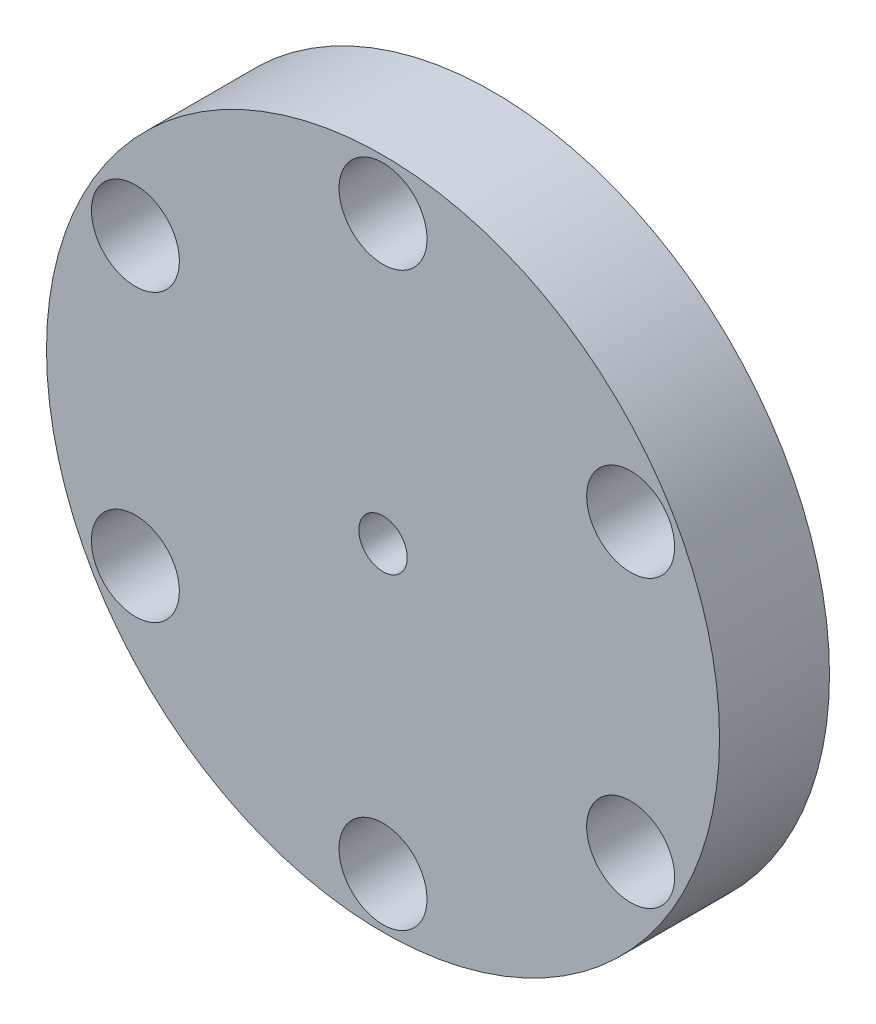
from build123d import *

# Parameters (mm, degrees)
SKETCH_1_R               = 15.3
SKETCH_1_R_2             = 1.1
EXTRUDE_1_DEPTH          = 2.5
SKETCH_2_R               = 1.25
CUT_EXTRUDE_1_DEPTH      = 23.207656337
SKETCH_2_2_R             = 2
CUT_EXTRUDE_2_DEPTH      = 3
PATTERN_CIRCULAR_1_COUNT = 6


with BuildPart() as part:
    # 草图1 → 凸台-拉伸1 (new, symmetric)
    with BuildSketch(Plane.XY):
        Circle(SKETCH_1_R)
        Circle(SKETCH_1_R_2, mode=Mode.SUBTRACT)
    extrude(amount=EXTRUDE_1_DEPTH, both=True)

    # 草图2 → 切除-拉伸1 (cut, through all)
    with BuildSketch(Plane.XY.offset(2.5)):
        with Locations((0, 13)):
            Circle(SKETCH_2_R)
    cut_extrude_1 = extrude(amount=-CUT_EXTRUDE_1_DEPTH, mode=Mode.SUBTRACT)

    # 草图2<2> → 切除-拉伸2 (cut)
    with BuildSketch(Plane.XY.offset(2.5)):
        with Locations((0, 13)):
            Circle(SKETCH_2_2_R)
    cut_extrude_2 = extrude(amount=-CUT_EXTRUDE_2_DEPTH, mode=Mode.SUBTRACT)

    # 阵列(圆周)1: 切除-拉伸1, 切除-拉伸2 ×6 about axis
    pattern_circular_1_axis = Axis((0, 0, 0), (0, 0, 1))
    add([cut_extrude_1.rotate(pattern_circular_1_axis, i * 360 / PATTERN_CIRCULAR_1_COUNT) for i in range(1, PATTERN_CIRCULAR_1_COUNT)], mode=Mode.SUBTRACT)
    add([cut_extrude_2.rotate(pattern_circular_1_axis, i * 360 / PATTERN_CIRCULAR_1_COUNT) for i in range(1, PATTERN_CIRCULAR_1_COUNT)], mode=Mode.SUBTRACT)


solid = part.part
